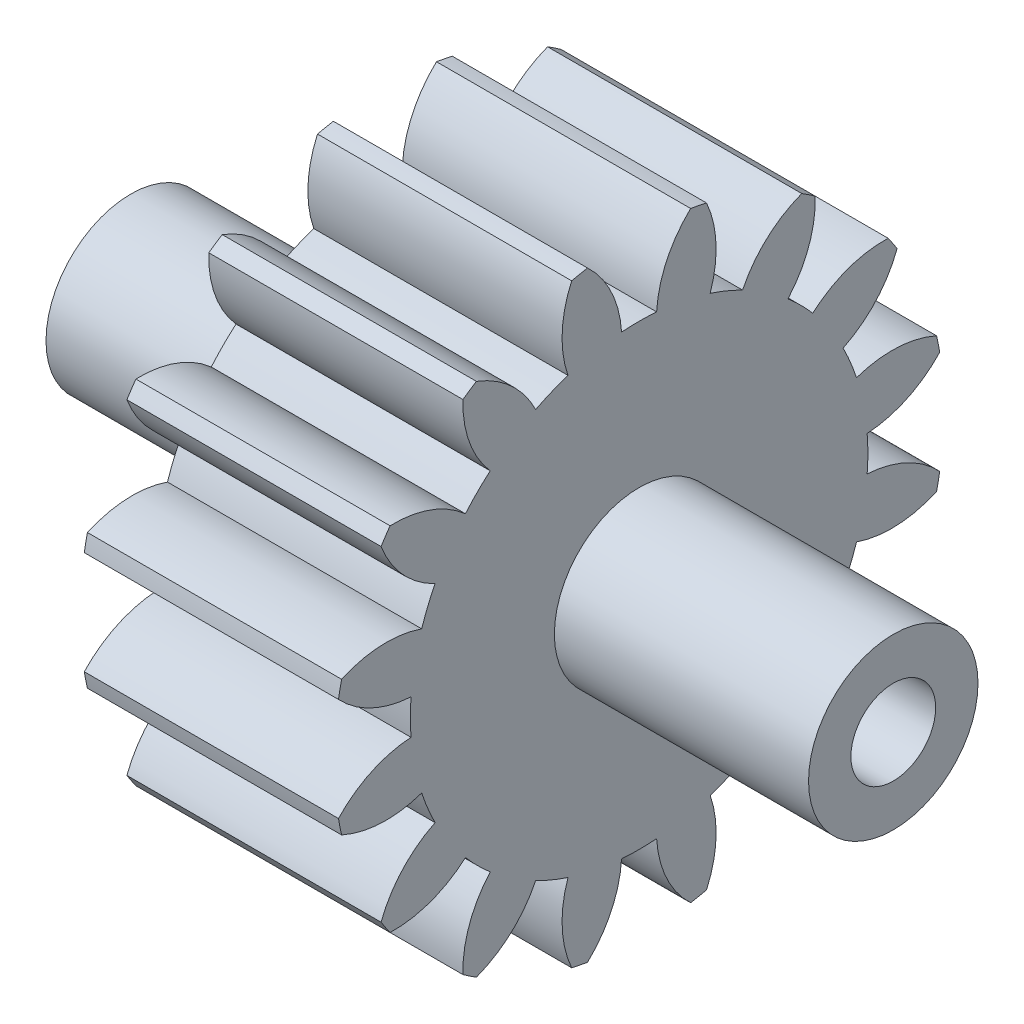
from build123d import *

# Parameters (mm, degrees)
BASPROSKE_W       = 15
BASPROSKE_H       = 18
TOOTHCUT_DEPTH    = 30.546573405
TEETHCUTS_COUNT   = 16
TEETHCUTS_ANGLE   = 337.5
HUBNEABOTSKE_R    = 5
HUBNEARBOTH_DEPTH = 15.0000254
HUBFAR_START      = 15.0000254
HUBFARSKE_R       = 5
HUBFAR_DEPTH      = 15.0000254
BORSKE_R          = 2.5
BORE_DEPTH        = 45.0000508


with BuildPart() as part:
    # BasProSke → Base-Revolve (revolve)
    with BuildSketch(Plane(origin=(0, 0, 0), x_dir=(1, 0, 0), z_dir=(0, 1, 0)), mode=Mode.PRIVATE) as base_revolve_sk:
        with Locations((7.5, 9)):
            Rectangle(BASPROSKE_W, BASPROSKE_H)
    revolve(base_revolve_sk.sketch.rotate(Axis((-10, 0, 0), (1, 0, 0)), 180), axis=Axis((-10, 0, 0), (1, 0, 0)))

    # TooCutSke → ToothCut (cut, through all)
    with BuildSketch(Plane(origin=(0, 0, 0), x_dir=(0, 0, -1), z_dir=(1, 0, 0))):
        with BuildLine():
            ThreePointArc((1.03434411, 13.459313997), (0, 13.499), (-1.03434411, 13.459313997))
            ThreePointArc((-1.03434411, 13.459313997), (-1.635143665, 15.806872195), (-3.065655864, 17.762792553))
            ThreePointArc((-3.065655864, 17.762792553), (0, 18.0254), (3.065655864, 17.762792553))
            ThreePointArc((3.065655864, 17.762792553), (1.635143665, 15.806872195), (1.03434411, 13.459313997))
        make_face()
    toothcut = extrude(amount=TOOTHCUT_DEPTH, mode=Mode.SUBTRACT)

    # TeethCuts: ToothCut ×16 about axis
    teethcuts_axis = Axis((-10, 0, 0), (1, 0, 0))
    for i in range(1, TEETHCUTS_COUNT):
        add(toothcut.rotate(teethcuts_axis, i * TEETHCUTS_ANGLE / (TEETHCUTS_COUNT - 1)), mode=Mode.SUBTRACT)

    # HubNeaBotSke → HubNearBoth (add)
    with BuildSketch(Plane.ZY):
        with Locations(Location((0, 0, 0), (0, 0, 180))):
            Circle(HUBNEABOTSKE_R)
    extrude(amount=HUBNEARBOTH_DEPTH)

    # HubFarSke → HubFar (add)
    with BuildSketch(Plane(origin=(15, 0, 0), x_dir=(0, 0, -1), z_dir=(1, 0, 0)).offset(HUBFAR_START)):
        Circle(HUBFARSKE_R)
    extrude(amount=-HUBFAR_DEPTH)

    # BorSke → Bore (cut, symmetric)
    with BuildSketch(Plane(origin=(0, 0, 0), x_dir=(0, 0, -1), z_dir=(1, 0, 0))):
        with Locations(Location((0, 0, 0), (0, 0, 180))):
            Circle(BORSKE_R)
    extrude(amount=BORE_DEPTH, both=True, mode=Mode.SUBTRACT)


solid = part.part
